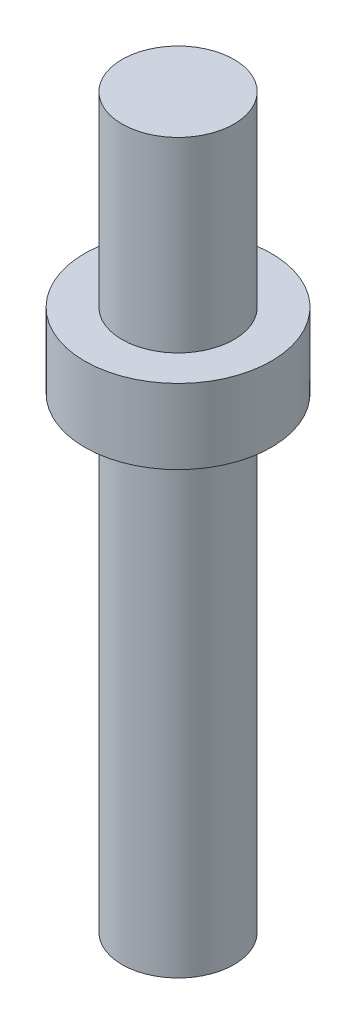
from build123d import *

# Parameters (mm, degrees)
SKETCH1_R           = 1.5
BOSS_EXTRUDE1_DEPTH = 12.5
SKETCH2_R           = 2.5
BOSS_EXTRUDE2_DEPTH = 2
SKETCH3_R           = 1.5
BOSS_EXTRUDE3_DEPTH = 5


with BuildPart() as part:
    # Sketch1 → Boss-Extrude1 (new body)
    with BuildSketch(Plane(origin=(0, 0, 0), x_dir=(1, 0, 0), z_dir=(0, 1, 0))):
        with Locations(Location((0, 0, 0), (0, 0, 270))):
            Circle(SKETCH1_R)
    extrude(amount=BOSS_EXTRUDE1_DEPTH)

    # Sketch2 → Boss-Extrude2 (add)
    with BuildSketch(Plane(origin=(0, 12.5, 0), x_dir=(1, 0, 0), z_dir=(0, 1, 0))):
        with Locations(Location((0, 0, 0), (0, 0, 270))):
            Circle(SKETCH2_R)
    extrude(amount=BOSS_EXTRUDE2_DEPTH)

    # Sketch3 → Boss-Extrude3 (add)
    with BuildSketch(Plane(origin=(0, 14.5, 0), x_dir=(1, 0, 0), z_dir=(0, 1, 0))):
        with Locations(Location((0, 0, 0), (0, 0, 270))):
            Circle(SKETCH3_R)
    extrude(amount=BOSS_EXTRUDE3_DEPTH)


solid = part.part
